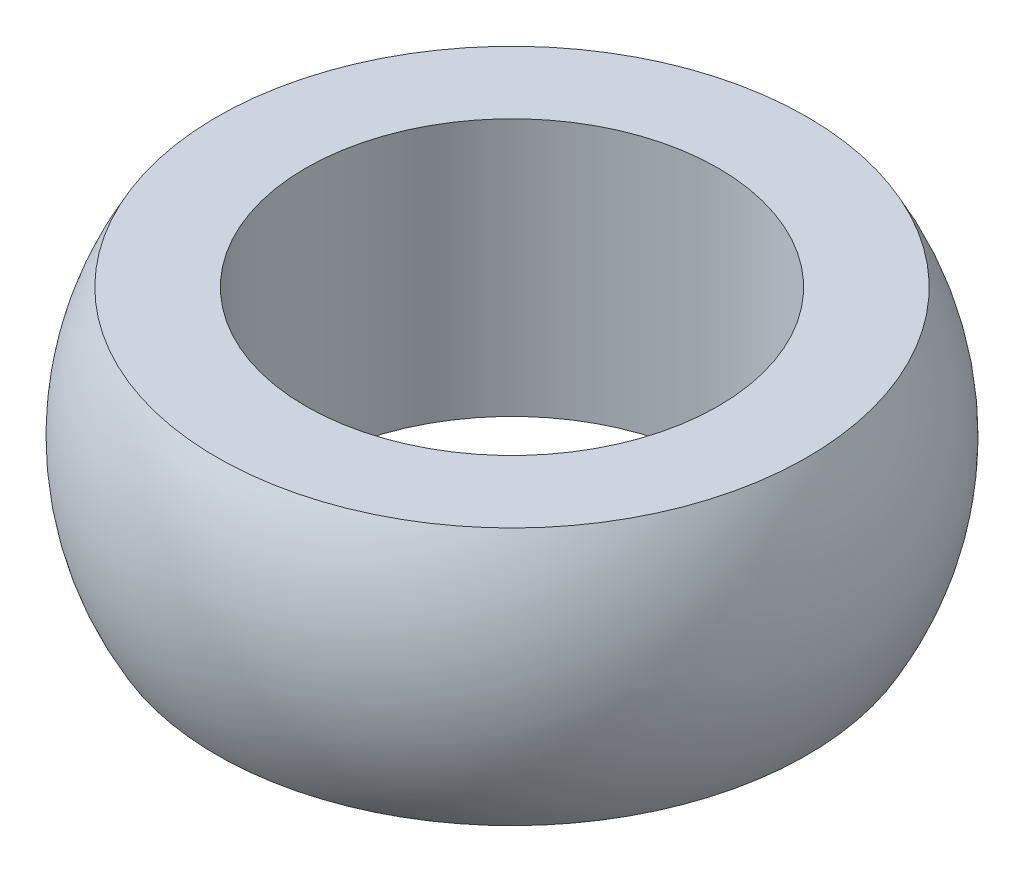
from build123d import *


with BuildPart() as part:
    # Sketch1 → Revolve1 (revolve)
    with BuildSketch(Plane.XY, mode=Mode.PRIVATE) as revolve1_sk:
        with BuildLine():
            Line((12, -7.5), (17.166500568, -7.5))
            ThreePointArc((17.166500568, -7.5), (19.176119511, 0), (17.166500568, 7.5))
            Line((17.166500568, 7.5), (12, 7.5))
            Line((12, 7.5), (12, -7.5))
        make_face()
    revolve(revolve1_sk.sketch.rotate(Axis((0, 0, 0), (0, 1, 0)), 90), axis=Axis((0, 0, 0), (0, 1, 0)))


solid = part.part
